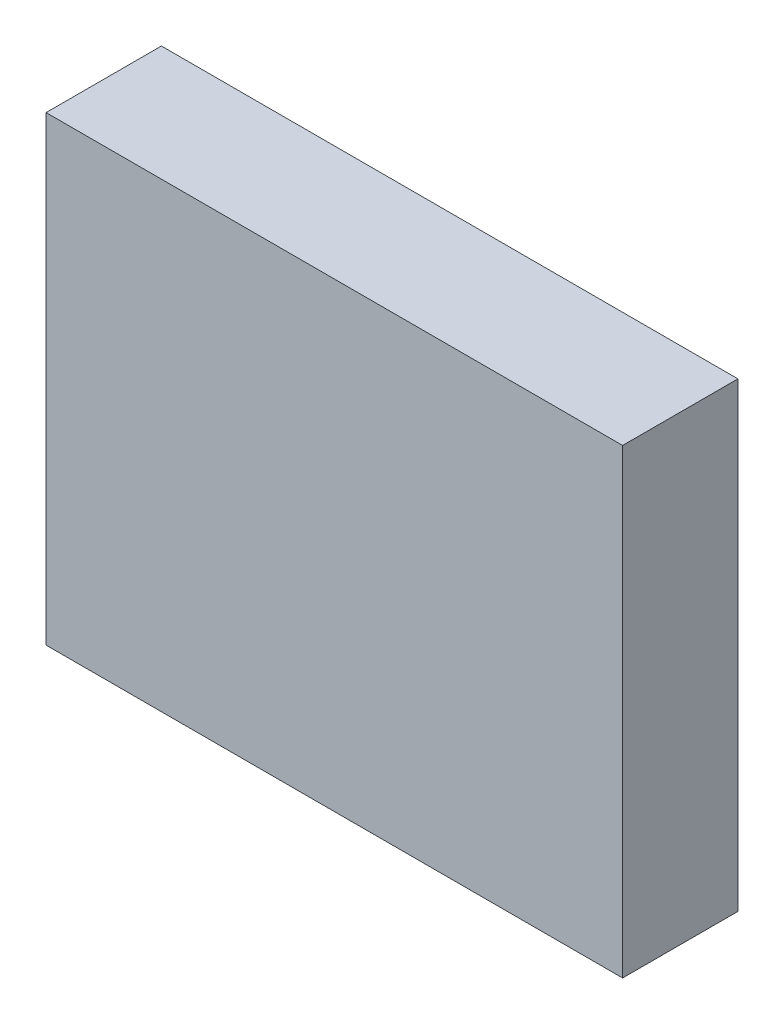
from build123d import *

# Parameters (mm, degrees)
SKETCH_1_W      = 25
SKETCH_1_H      = 20
EXTRUDE_1_DEPTH = 5


with BuildPart() as part:
    # 草图1 → 凸台-拉伸1 (new body)
    with BuildSketch(Plane.XY):
        Rectangle(SKETCH_1_W, SKETCH_1_H)
    extrude(amount=EXTRUDE_1_DEPTH)


solid = part.part
